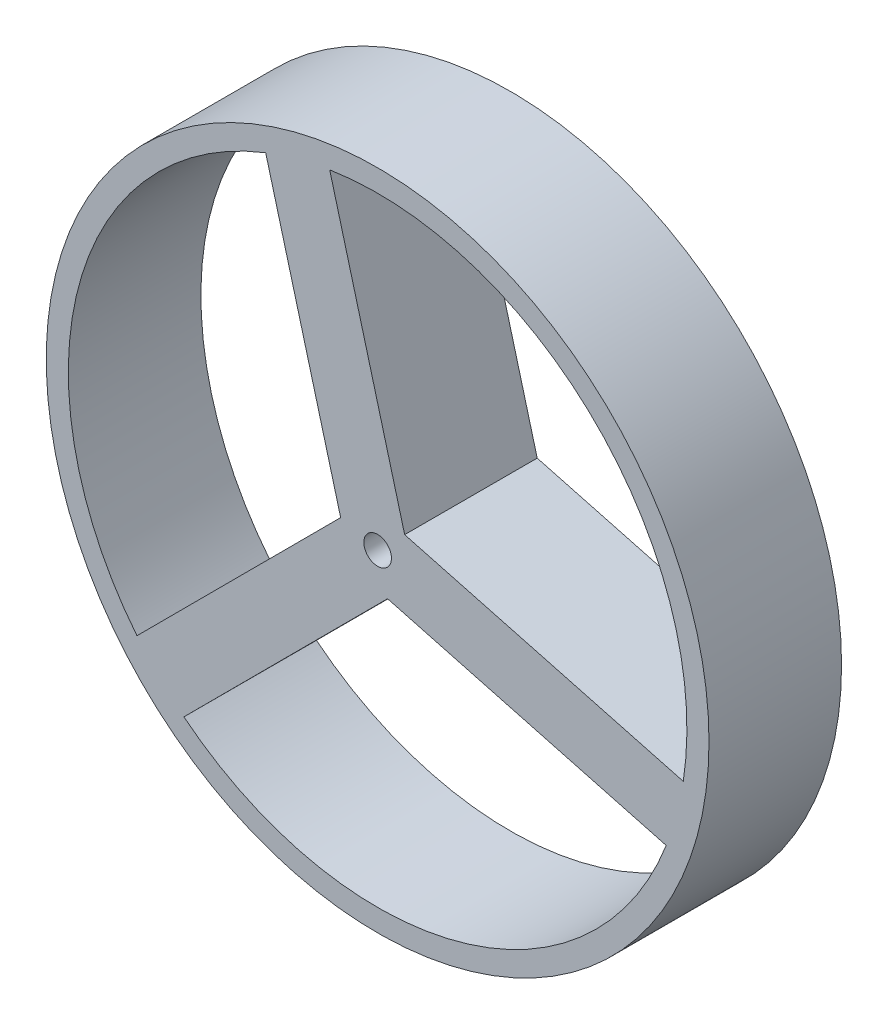
from build123d import *

# Parameters (mm, degrees)
SKETCH2_R           = 30
BOSS_EXTRUDE1_DEPTH = 12
SKETCH4_R           = 1.25
CUT_EXTRUDE1_DEPTH  = 45.09081537


with BuildPart() as part:
    # Sketch2 → Boss-Extrude1 (new body)
    with BuildSketch(Plane.XY):
        Circle(SKETCH2_R)
        with BuildLine():
            Line((-10.13235825, 26.102400585), (-3.347071467, 0.892811622))
            Line((-3.347071467, 0.892811622), (-21.786572537, -17.588213585))
            ThreePointArc((-21.786572537, -17.588213585), (-27.054056577, 7.216510426), (-10.13235825, 26.102400585))
        make_face(mode=Mode.SUBTRACT)
        with BuildLine():
            Line((-17.539162882, -21.826079937), (0.900338188, -3.34505473))
            Line((0.900338188, -3.34505473), (26.12512604, -10.073618486))
            ThreePointArc((26.12512604, -10.073618486), (7.277346933, -27.037755484), (-17.539162882, -21.826079937))
        make_face(mode=Mode.SUBTRACT)
        with BuildLine():
            Line((-4.338553503, 27.661832071), (2.446733279, 2.452243108))
            Line((2.446733279, 2.452243108), (27.671521131, -4.276320648))
            ThreePointArc((27.671521131, -4.276320648), (19.776709644, 19.821245058), (-4.338553503, 27.661832071))
        make_face(mode=Mode.SUBTRACT)
    extrude(amount=BOSS_EXTRUDE1_DEPTH)

    # Sketch4 → Cut-Extrude1 (cut, through all)
    with BuildSketch(Plane.XY.offset(12)):
        Circle(SKETCH4_R)
    extrude(amount=-CUT_EXTRUDE1_DEPTH, mode=Mode.SUBTRACT)


solid = part.part
